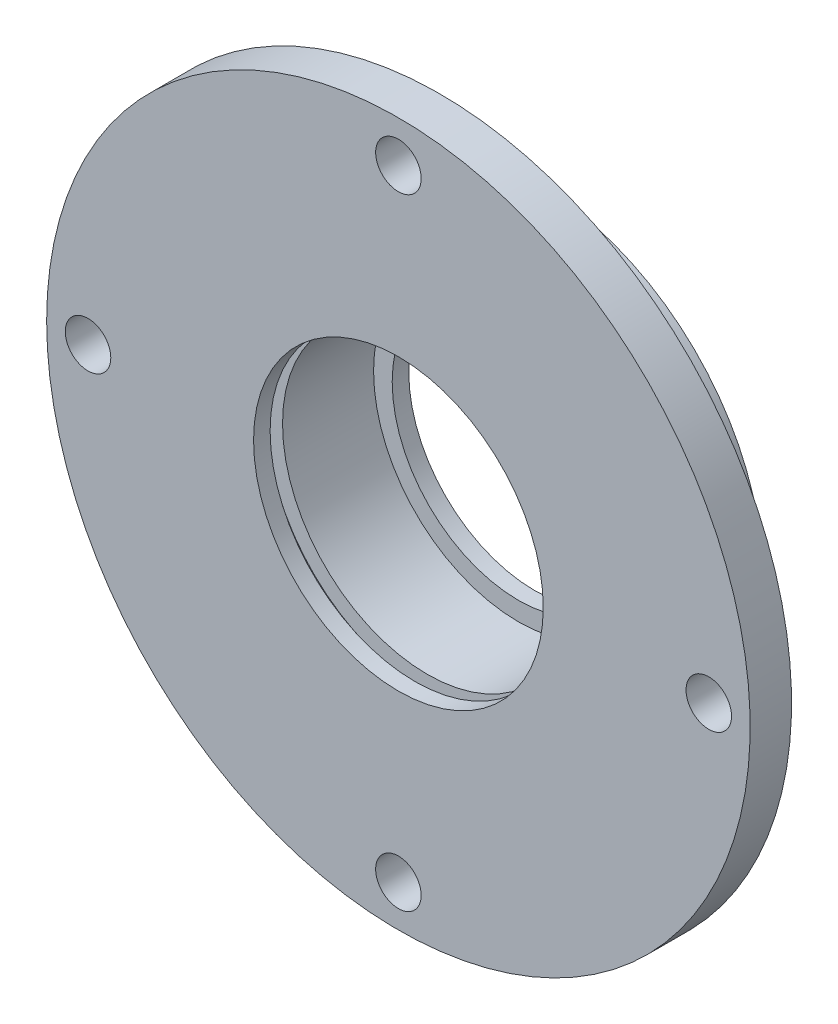
from build123d import *

# Parameters (mm, degrees)
SKETCH3_R          = 2.75
CUT_EXTRUDE2_DEPTH = 61.850225965
SKETCH4_W          = 19.5
SKETCH4_H          = 1.5


with BuildPart() as part:
    # Sketch2 → Revolve1 (revolve)
    with BuildSketch(Plane(origin=(0, 0, 0), x_dir=(1, 0, 0), z_dir=(0, 1, 0)), mode=Mode.PRIVATE) as revolve1_sk:
        Polygon((17.5, -7), (42.5, -7), (42.5, -2), (22.5, -2), (22.5, 2), (27.5, 2), (27.5, 9.5), (15.25, 9.5), (15.25, 7.5), (17.5, 7.5), align=None)
    revolve(revolve1_sk.sketch.rotate(Axis((0, 0, -30.507012698), (0, 0, 1)), 180), axis=Axis((0, 0, -30.507012698), (0, 0, 1)))

    # Sketch3 → Cut-Extrude2 (cut, through all)
    with BuildSketch(Plane.XY):
        with Locations((0, 37.5)):
            Circle(SKETCH3_R)
        with Locations((37.5, 0)):
            Circle(SKETCH3_R)
        with Locations((0, -37.5)):
            Circle(SKETCH3_R)
        with Locations((-37.5, 0)):
            Circle(SKETCH3_R)
    extrude(amount=CUT_EXTRUDE2_DEPTH, mode=Mode.SUBTRACT)

    # Sketch4 → Cut-Revolve1 (revolve, cut)
    with BuildSketch(Plane(origin=(0, 0, 0), x_dir=(1, 0, 0), z_dir=(0, 1, 0)), mode=Mode.PRIVATE) as cut_revolve1_sk:
        with Locations((9.75, -4.25)):
            Rectangle(SKETCH4_W, SKETCH4_H)
    revolve(cut_revolve1_sk.sketch.rotate(Axis((0, 0, -30.507012698), (0, 0, 1)), 180), axis=Axis((0, 0, -30.507012698), (0, 0, 1)), mode=Mode.SUBTRACT)


solid = part.part
